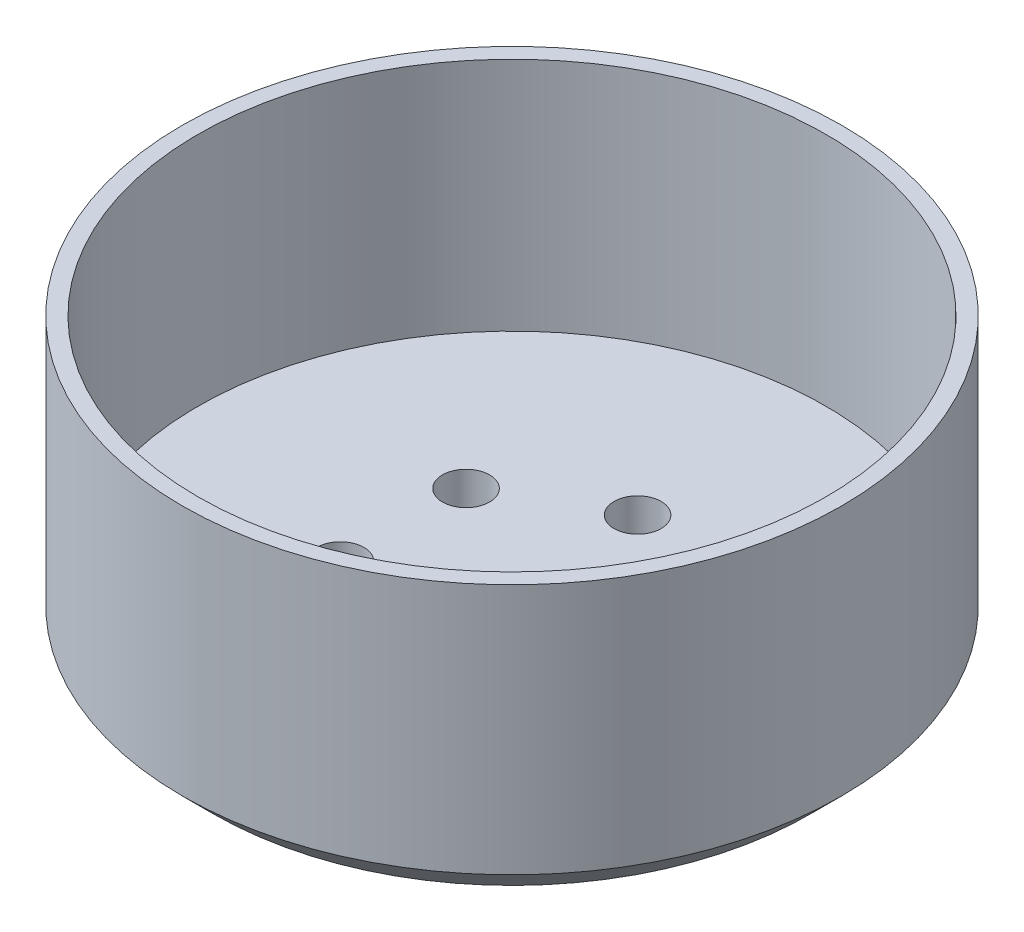
from build123d import *

# Parameters (mm, degrees)
SKETCH_1_R          = 20
EXTRUDE_1_DEPTH     = 3
SKETCH_1_3_R        = 21
SKETCH_1_3_R_2      = 20
EXTRUDE_2_DEPTH     = 18
SKETCH_4_R          = 1.5
CUT_EXTRUDE_1_DEPTH = 17
SKETCH_5_R          = 3.5
EXTRUDE_3_DEPTH     = 1


with BuildPart() as part:
    # 草图1 → 凸台-拉伸1 (new body)
    with BuildSketch(Plane(origin=(0, 0, 0), x_dir=(1, 0, 0), z_dir=(0, 1, 0))):
        Circle(SKETCH_1_R)
    extrude(amount=EXTRUDE_1_DEPTH)

    # 草图1<3> → 凸台-拉伸2 (add)
    with BuildSketch(Plane(origin=(0, 0, 0), x_dir=(1, 0, 0), z_dir=(0, 1, 0))):
        Circle(SKETCH_1_3_R)
        Circle(SKETCH_1_3_R_2, mode=Mode.SUBTRACT)
    extrude(amount=EXTRUDE_2_DEPTH)

    # 草图3 → 切除-旋转1 (revolve, cut)
    with BuildSketch(Plane.XY):
        Polygon((19, 0), (21, 2), (21, 0), align=None)
    revolve(axis=Axis((0, 18, 0), (0, -1, 0)), mode=Mode.SUBTRACT)

    # 草图4 → 切除-拉伸1 (cut)
    with BuildSketch(Plane.XZ):
        with Locations((0, 8)):
            Circle(SKETCH_4_R)
        with Locations((6.92820323, 4)):
            Circle(SKETCH_4_R)
        with Locations((6.92820323, -4)):
            Circle(SKETCH_4_R)
        with Locations((0, -8)):
            Circle(SKETCH_4_R)
        with Locations((-6.92820323, -4)):
            Circle(SKETCH_4_R)
        with Locations((-6.92820323, 4)):
            Circle(SKETCH_4_R)
    extrude(amount=-CUT_EXTRUDE_1_DEPTH, mode=Mode.SUBTRACT)

    # 草图5 → 凸台-拉伸3 (add)
    with BuildSketch(Plane.XZ):
        Circle(SKETCH_5_R)
    extrude(amount=EXTRUDE_3_DEPTH)


solid = part.part
